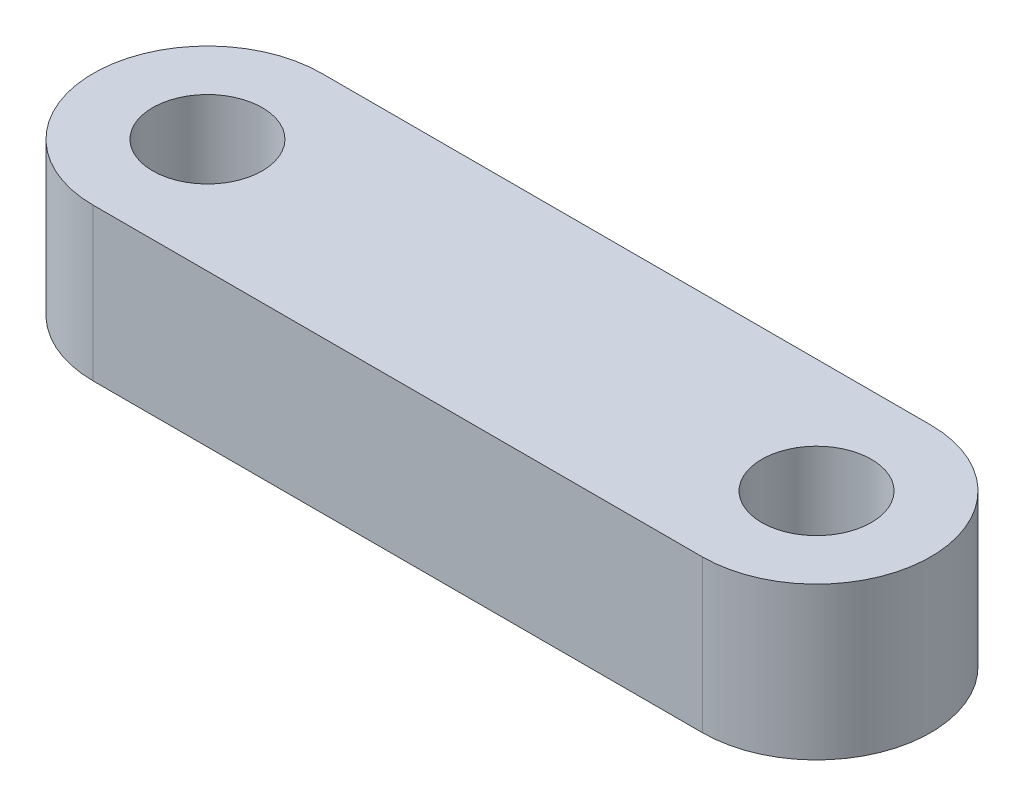
from build123d import *

# Parameters (mm, degrees)
SKETCH1_R           = 2.286
BOSS_EXTRUDE1_DEPTH = 6.35


with BuildPart() as part:
    # Sketch1 → Boss-Extrude1 (new body)
    with BuildSketch(Plane(origin=(0, 0, 0), x_dir=(1, 0, 0), z_dir=(0, 1, 0))):
        with BuildLine():
            Line((0, -4.7625), (-25.4, -4.7625))
            ThreePointArc((-25.4, -4.7625), (-30.1625, 0), (-25.4, 4.7625))
            Line((-25.4, 4.7625), (0, 4.7625))
            ThreePointArc((0, 4.7625), (4.7625, 0), (0, -4.7625))
        make_face()
        with Locations(Location((-25.4, 0, 0), (0, 0, 270))):
            Circle(SKETCH1_R, mode=Mode.SUBTRACT)
        with Locations(Location((0, 0, 0), (0, 0, 270))):
            Circle(SKETCH1_R, mode=Mode.SUBTRACT)
    extrude(amount=BOSS_EXTRUDE1_DEPTH)


solid = part.part
